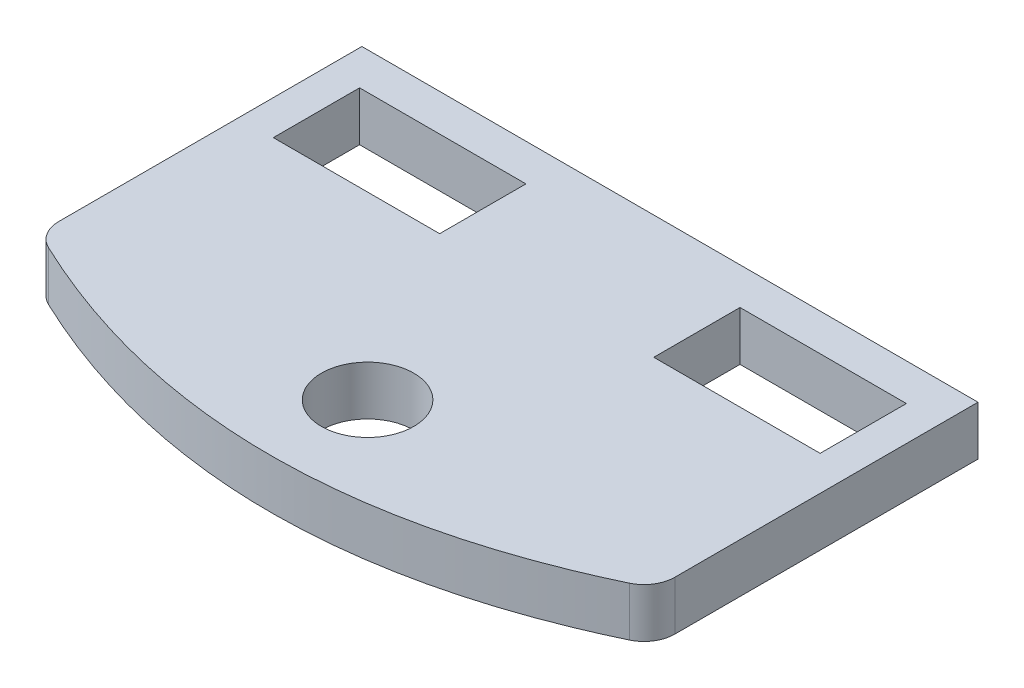
from build123d import *

# Parameters (mm, degrees)
SKETCH_1_R      = 1.5
SKETCH_1_W      = 5.4
SKETCH_1_H      = 2.8
EXTRUDE_1_DEPTH = 1.6


with BuildPart() as part:
    # 스케치1 → 보스-돌출1 (new body)
    with BuildSketch(Plane(origin=(0, 0, 0), x_dir=(1, 0, 0), z_dir=(0, 1, 0))):
        with BuildLine():
            Line((-10, 5.634530717), (10, 5.634530717))
            Line((10, 5.634530717), (10, -4.207222136))
            ThreePointArc((10, -4.207222136), (9.845653495, -4.740954435), (9.430259666, -5.109927304))
            add(Edge.make_bspline(
                [(-9.428195587, -5.109155368), (-6.286031575, -6.598013928), (-0.00904299, -8.087277746), (6.306496469, -6.598817984), (9.430259666, -5.109927304)],
                knots=[0.028590221, 0.028590221, 0.028590221, 0.028590221, 0.499914822, 0.971328473, 0.971328473, 0.971328473, 0.971328473], degree=3))
            ThreePointArc((-9.428195587, -5.109155368), (-9.845043072, -4.740167522), (-10, -4.205469283))
            Line((-10, -4.205469283), (-10, 5.634530717))
        make_face()
        with Locations(Location((0.025, -4.205469283, 0), (0, 0, 270))):
            Circle(SKETCH_1_R, mode=Mode.SUBTRACT)
        with Locations((6.175, 3.034530717)):
            Rectangle(SKETCH_1_W, SKETCH_1_H, mode=Mode.SUBTRACT)
        with Locations((-6.175, 3.034530717)):
            Rectangle(SKETCH_1_W, SKETCH_1_H, mode=Mode.SUBTRACT)
    extrude(amount=EXTRUDE_1_DEPTH)


solid = part.part
